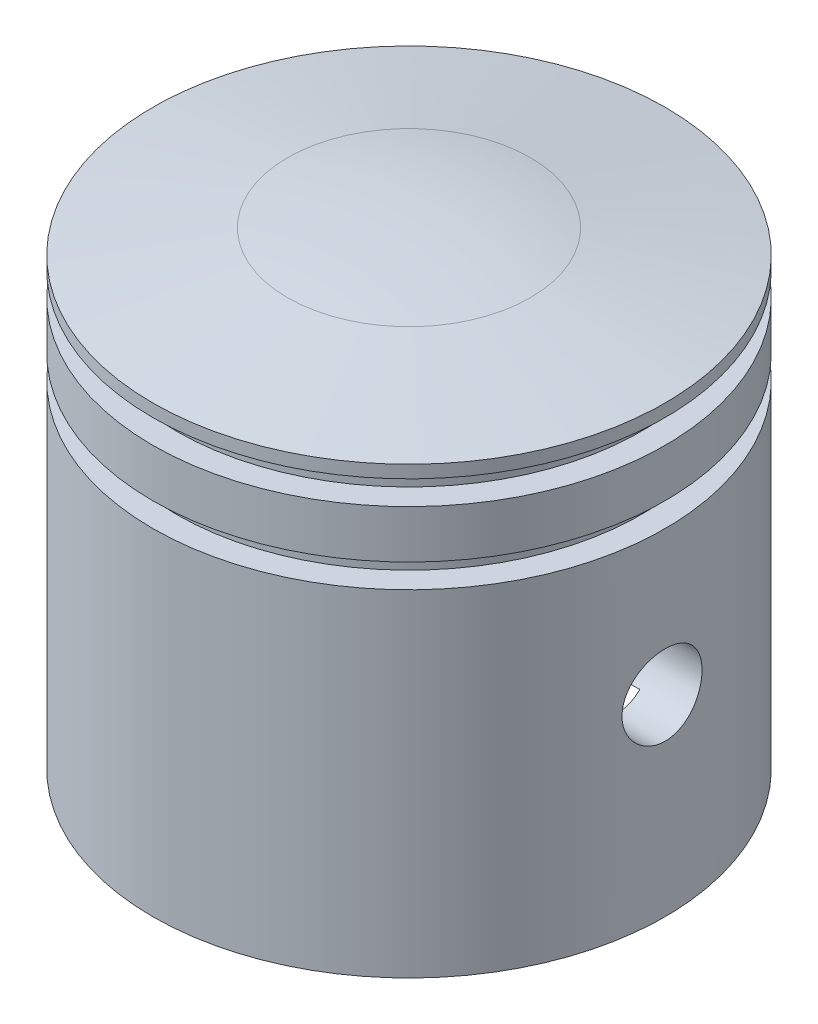
from build123d import *

# Parameters (mm, degrees)
SKETCH2_W               = 4.716400703
SKETCH2_H               = 1.5
SKETCH3_R               = 10
CUT_EXTRUDE1_DEPTH      = 24
SKETCH4_R               = 13
CUT_EXTRUDE2_DEPTH      = 10
CUT_EXTRUDE3_DEPTH      = 38.576588456
CUT_EXTRUDE3_DEPTH_BACK = 38.576588456
SKETCH5_R               = 2.5


with BuildPart() as part:
    # Sketch1 → Revolve1 (revolve)
    with BuildSketch(Plane.XY, mode=Mode.PRIVATE) as revolve1_sk:
        with BuildLine():
            Line((0, 0), (16, 0))
            Line((16, 0), (16, 27.790539739))
            Line((16, 27.790539739), (7.58095419, 29.275044667))
            ThreePointArc((7.58095419, 29.275044667), (3.807769251, 29.818348702), (0, 30))
            Line((0, 30), (0, 0))
        make_face()
    revolve(revolve1_sk.sketch.rotate(Axis((0, 30, 0), (0, -1, 0)), 90), axis=Axis((0, 30, 0), (0, -1, 0)))

    # Sketch2 → Cut-Revolve1 (revolve, cut)
    with BuildSketch(Plane.XY, mode=Mode.PRIVATE) as cut_revolve1_sk:
        with Locations((16.858200352, 26.25)):
            Rectangle(SKETCH2_W, SKETCH2_H)
        with Locations((16.858200352, 21.75)):
            Rectangle(SKETCH2_W, SKETCH2_H)
    revolve(cut_revolve1_sk.sketch.rotate(Axis((0, 0, 0), (0, 1, 0)), 270), axis=Axis((0, 0, 0), (0, 1, 0)), mode=Mode.SUBTRACT)

    # Sketch3 → Cut-Extrude1 (cut)
    with BuildSketch(Plane.XZ):
        with Locations(Location((0, 0, 0), (0, 0, 270))):
            Circle(SKETCH3_R)
    extrude(amount=-CUT_EXTRUDE1_DEPTH, mode=Mode.SUBTRACT)

    # Sketch4 → Cut-Extrude2 (cut)
    with BuildSketch(Plane.XZ):
        with Locations(Location((0, 0, 0), (0, 0, 270))):
            Circle(SKETCH4_R)
    extrude(amount=-CUT_EXTRUDE2_DEPTH, mode=Mode.SUBTRACT)

    # Sketch5 → Cut-Extrude3 (cut, two sides: drawn at the far end of the back side and taken through both)
    with BuildSketch(Plane(origin=(0, 0, 0), x_dir=(0, 0, -1), z_dir=(1, 0, 0)).offset(-CUT_EXTRUDE3_DEPTH_BACK)):
        with Locations(Location((0, 12, 0), (0, 0, 306.869897646))):
            Circle(SKETCH5_R)
    extrude(amount=CUT_EXTRUDE3_DEPTH + CUT_EXTRUDE3_DEPTH_BACK, mode=Mode.SUBTRACT)


solid = part.part
